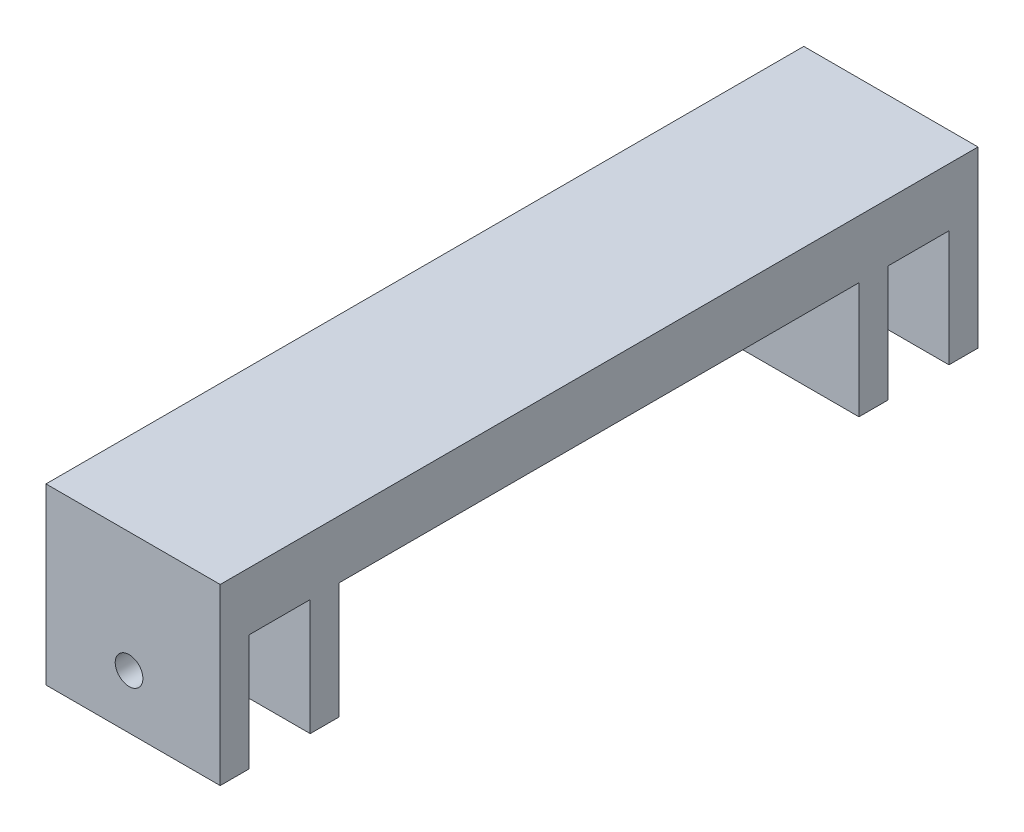
from build123d import *

# Parameters (mm, degrees)
ESQUISSE1_W                             = 30
ESQUISSE1_H                             = 10
BOSS_EXTRU_1_DEPTH                      = 130.5
ESQUISSE2_W                             = 30
ESQUISSE2_H                             = 5
BOSS_EXTRU_2_DEPTH                      = 20
PER_AGE_POUR_CROUS_AUTO_BLOQUANTS_300_D = 4.7625


with BuildPart() as part:
    # Esquisse1 → Boss.-Extru.1 (new body)
    with BuildSketch(Plane.XY):
        with Locations((15, 5)):
            Rectangle(ESQUISSE1_W, ESQUISSE1_H)
    extrude(amount=BOSS_EXTRU_1_DEPTH)

    # Esquisse2 → Boss.-Extru.2 (add)
    with BuildSketch(Plane.XZ):
        with Locations((15, 2.5)):
            Rectangle(ESQUISSE2_W, ESQUISSE2_H)
        with Locations((15, 18)):
            Rectangle(ESQUISSE2_W, ESQUISSE2_H)
        with Locations((15, 128)):
            Rectangle(ESQUISSE2_W, ESQUISSE2_H)
        with Locations((15, 112.5)):
            Rectangle(ESQUISSE2_W, ESQUISSE2_H)
    extrude(amount=BOSS_EXTRU_2_DEPTH)

    # Perçage pour écrous auto-bloquants 300® #6 (SP)1 (through all)
    with Locations(Plane.XY.offset(130.5)):
        with Locations((14.302143115, -10.686909811)):
            Hole(PER_AGE_POUR_CROUS_AUTO_BLOQUANTS_300_D / 2)


solid = part.part
